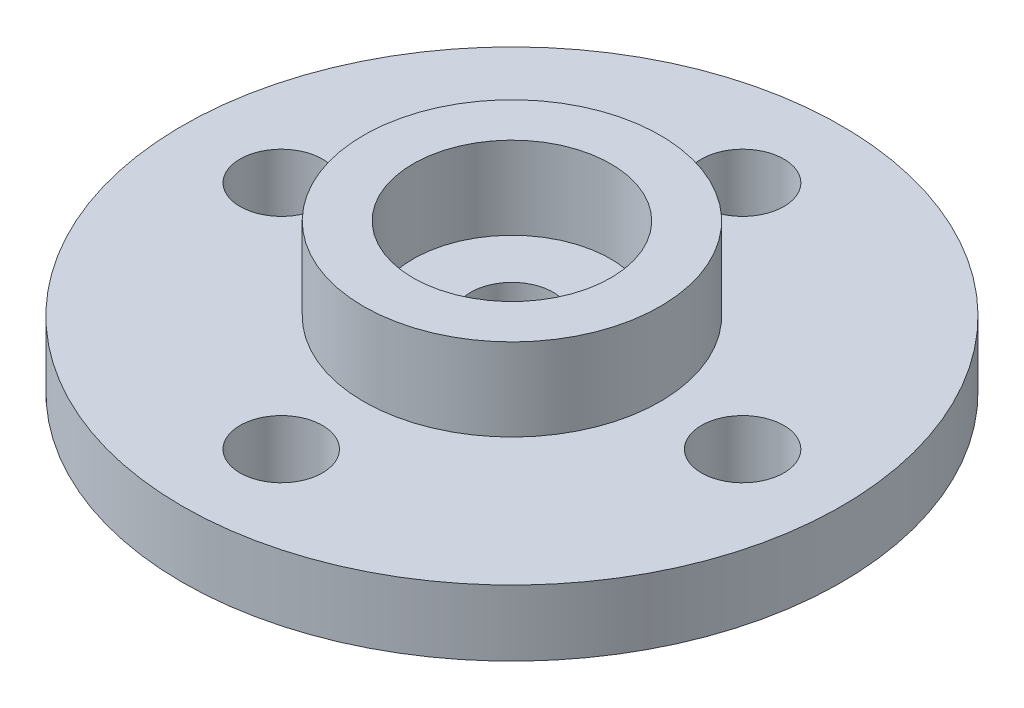
from build123d import *

# Parameters (mm, degrees)
SKETCH_1_R      = 10
SKETCH_1_R_2    = 1.25
EXTRUDE_1_DEPTH = 2
SKETCH_2_R      = 4.5
SKETCH_2_R_2    = 3
EXTRUDE_2_DEPTH = 2.5


with BuildPart() as part:
    # Эскиз1 → Бобышка-Вытянуть1 (new body)
    with BuildSketch(Plane(origin=(0, 0, 0), x_dir=(1, 0, 0), z_dir=(0, 1, 0))):
        with Locations(Location((0, 0, 0), (0, 0, 270))):
            Circle(SKETCH_1_R)
        with Locations(Location((7, 0, 0), (0, 0, 270))):
            Circle(SKETCH_1_R_2, mode=Mode.SUBTRACT)
        with Locations(Location((0, 0, 0), (0, 0, 270))):
            Circle(SKETCH_1_R_2, mode=Mode.SUBTRACT)
        with Locations(Location((0, -7, 0), (0, 0, 270))):
            Circle(SKETCH_1_R_2, mode=Mode.SUBTRACT)
        with Locations(Location((-7, 0, 0), (0, 0, 270))):
            Circle(SKETCH_1_R_2, mode=Mode.SUBTRACT)
        with Locations(Location((0, 7, 0), (0, 0, 270))):
            Circle(SKETCH_1_R_2, mode=Mode.SUBTRACT)
    extrude(amount=EXTRUDE_1_DEPTH)

    # Эскиз2 → Бобышка-Вытянуть2 (add)
    with BuildSketch(Plane(origin=(0, 2, 0), x_dir=(1, 0, 0), z_dir=(0, 1, 0))):
        with Locations(Location((0, 0, 0), (0, 0, 270))):
            Circle(SKETCH_2_R)
        with Locations(Location((0, 0, 0), (0, 0, 270))):
            Circle(SKETCH_2_R_2, mode=Mode.SUBTRACT)
    extrude(amount=EXTRUDE_2_DEPTH)


solid = part.part
